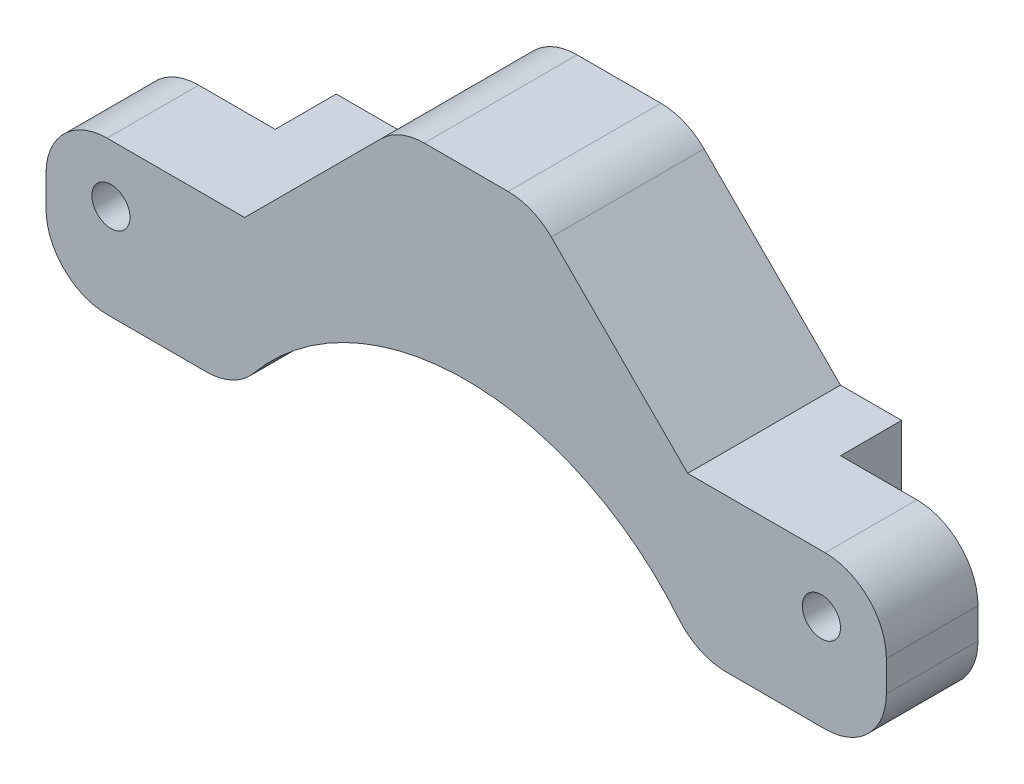
from build123d import *

# Parameters (mm, degrees)
CROQUIS1_R              = 1.25
SALIENTE_EXTRUIR1_DEPTH = 10
CROQUIS2_W              = 9
CROQUIS2_H              = 10
CORTAR_EXTRUIR1_DEPTH   = 4
CORTAR_EXTRUIR2_DEPTH   = 1.5
REDONDEO2_R             = 4


with BuildPart() as part:
    # Croquis1 → Saliente-Extruir1 (new body)
    with BuildSketch(Plane.XY):
        with BuildLine():
            Line((-68.837310195, 14.25), (-55.837310195, 14.25))
            Line((-55.837310195, 14.25), (-45.737310195, 24.35))
            Line((-45.737310195, 24.35), (-36.937310195, 24.35))
            Line((-36.937310195, 24.35), (-26.837310195, 14.25))
            Line((-26.837310195, 14.25), (-13.837310195, 14.25))
            Line((-13.837310195, 14.25), (-13.837310195, 4.25))
            Line((-13.837310195, 4.25), (-26.337310195, 4.25))
            ThreePointArc((-26.337310195, 4.25), (-41.337310195, 12.292271557), (-56.337310195, 4.25))
            Line((-56.337310195, 4.25), (-68.837310195, 4.25))
            Line((-68.837310195, 4.25), (-68.837310195, 14.25))
        make_face()
        with Locations((-18.087310195, 10.5)):
            Circle(CROQUIS1_R, mode=Mode.SUBTRACT)
        with Locations((-64.587310195, 10.5)):
            Circle(CROQUIS1_R, mode=Mode.SUBTRACT)
    extrude(amount=SALIENTE_EXTRUIR1_DEPTH)

    # Croquis2 → Cortar-Extruir1 (cut)
    with BuildSketch(Plane(origin=(0, 0, 0), x_dir=(-1, 0, 0), z_dir=(0, 0, -1))):
        with Locations((64.337310195, 9.25)):
            Rectangle(CROQUIS2_W, CROQUIS2_H)
        with Locations((18.337310195, 9.25)):
            Rectangle(CROQUIS2_W, CROQUIS2_H)
    extrude(amount=-CORTAR_EXTRUIR1_DEPTH, mode=Mode.SUBTRACT)

    # Croquis3 → Cortar-Extruir2 (cut)
    with BuildSketch(Plane(origin=(0, 0, 4), x_dir=(-1, 0, 0), z_dir=(0, 0, -1))):
        Polygon((62.104704038, 10.5), (63.346007116, 8.35), (65.828613274, 8.35), (67.069916353, 10.5), (65.828613274, 12.65), (63.346007116, 12.65), align=None)
        Polygon((15.604704038, 10.5), (16.846007116, 8.35), (19.328613274, 8.35), (20.569916353, 10.5), (19.328613274, 12.65), (16.846007116, 12.65), align=None)
    extrude(amount=-CORTAR_EXTRUIR2_DEPTH, mode=Mode.SUBTRACT)

    # Redondeo2
    redondeo2_edges = [part.edges().sort_by_distance(p)[0] for p in [
        (-68.837310195, 14.25, 7),
        (-45.737310195, 24.35, 5),
        (-36.937310195, 24.35, 5),
        (-13.837310195, 14.25, 7),
        (-13.837310195, 4.25, 7),
        (-26.337310195, 4.25, 5),
        (-56.337310195, 4.25, 5),
        (-68.837310195, 4.25, 7),
    ]]
    fillet(redondeo2_edges, radius=REDONDEO2_R)


solid = part.part
